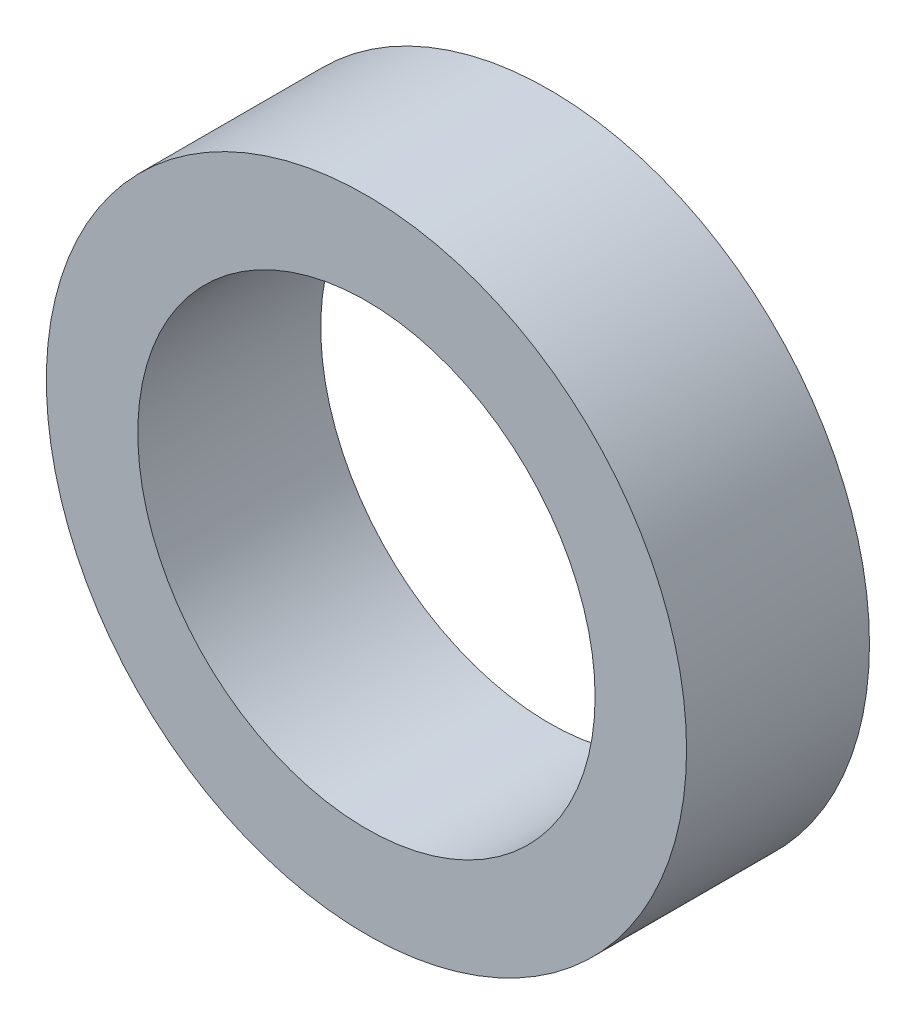
from build123d import *

# Parameters (mm, degrees)
SKETCH_1_R      = 7
SKETCH_1_R_2    = 5
EXTRUDE_1_DEPTH = 4


with BuildPart() as part:
    # 草图1 → 凸台-拉伸1 (new body)
    with BuildSketch(Plane.XY):
        Circle(SKETCH_1_R)
        Circle(SKETCH_1_R_2, mode=Mode.SUBTRACT)
    extrude(amount=EXTRUDE_1_DEPTH)


solid = part.part
